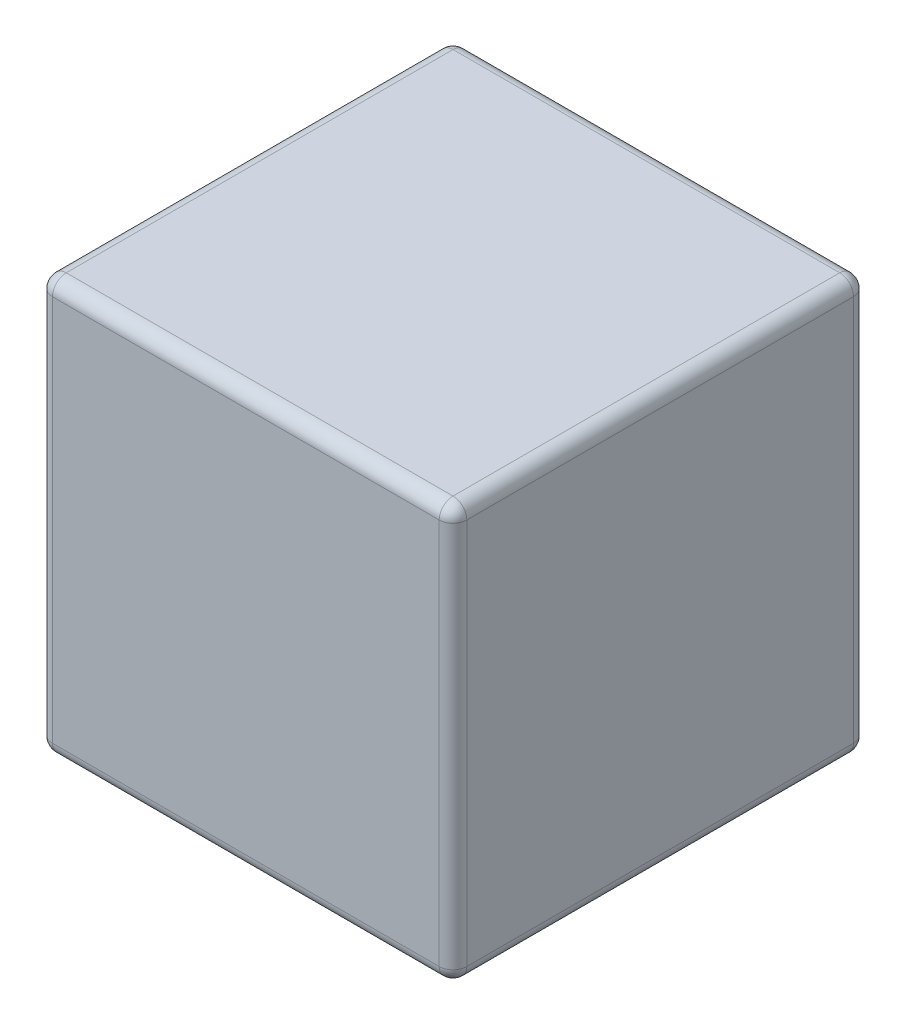
from build123d import *

# Parameters (mm, degrees)
ESQUISSE1_W        = 30
ESQUISSE1_H        = 30
BOSS_EXTRU_1_DEPTH = 30
CONG_1_R           = 1


with BuildPart() as part:
    # Esquisse1 → Boss.-Extru.1 (new body)
    with BuildSketch(Plane.XY):
        Rectangle(ESQUISSE1_W, ESQUISSE1_H)
    extrude(amount=BOSS_EXTRU_1_DEPTH)

    # Congé1
    cong_1_edges = [part.edges().sort_by_distance(p)[0] for p in [
        (-15, 0, 30),
        (0, -15, 30),
        (15, 0, 30),
        (0, -15, 0),
        (-15, 0, 0),
        (0, 15, 0),
        (15, 0, 0),
        (15, -15, 15),
        (-15, -15, 15),
        (-15, 15, 15),
        (15, 15, 15),
        (0, 15, 30),
    ]]
    fillet(cong_1_edges, radius=CONG_1_R)


solid = part.part
